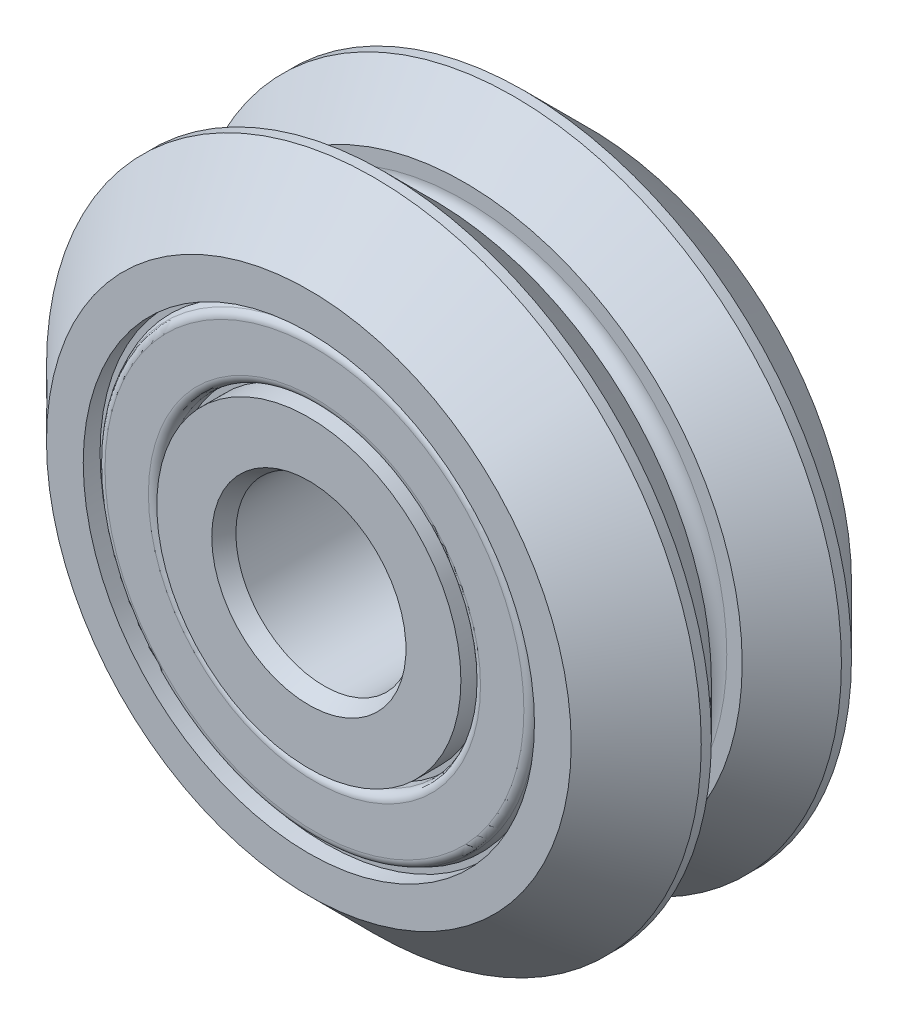
from build123d import *
from build123d.topology import SkipClean

# Parameters (mm, degrees)
SKETCH3_W      = 3.175
SKETCH3_H      = 1.44448
CHAMFER1_SIZE  = 0.2
CHAMFER1_SIZE2 = 0.346410162
FILLET1_R      = 0.1905


with BuildPart() as part:
    # Sketch3 → Revolve1 (revolve)
    with BuildSketch(Plane(origin=(0, 0, 0), x_dir=(0, 0, -1), z_dir=(1, 0, 0)), mode=Mode.PRIVATE) as revolve1_sk:
        with Locations((-1.5875, 2.72224)):
            Rectangle(SKETCH3_W, SKETCH3_H)
    revolve(revolve1_sk.sketch.rotate(Axis((0, 0, 3.175), (0, 0, -1)), 90), axis=Axis((0, 0, 3.175), (0, 0, -1)))

    # Chamfer1
    chamfer1_edges = [part.edges().sort_by_distance(p)[0] for p in [
        (-2, 0, 3.175),
    ]]
    chamfer1_side = [part.faces().sort_by_distance(p)[0] for p in [
        (-2.097424607, 0, 3.175),
    ]]
    chamfer(chamfer1_edges, length=CHAMFER1_SIZE, length2=CHAMFER1_SIZE2, reference=chamfer1_side[0])

    # Mirror1: part across plane


with BuildPart() as body_2:
    # Sketch4 → Revolve2 (revolve)
    with BuildSketch(Plane(origin=(0, 0, 0), x_dir=(0, 0, -1), z_dir=(1, 0, 0)), mode=Mode.PRIVATE) as revolve2_sk:
        with BuildLine():
            Line((0, 5.59435), (0, 3.44448))
            Line((0, 3.44448), (-2.6035, 3.44448))
            Line((-2.6035, 3.44448), (-2.6035, 5.111187692))
            Line((-2.6035, 5.111187692), (-3.175, 5.111187692))
            Line((-3.175, 5.111187692), (-3.175, 5.9436))
            Line((-3.175, 5.9436), (-1.7018, 7.4168))
            Line((-1.7018, 7.4168), (-1.4732, 7.4168))
            Line((-1.4732, 7.4168), (-0.34925, 6.29285))
            Line((-0.34925, 6.29285), (-0.34925, 5.9436))
            ThreePointArc((-0.34925, 5.9436), (-0.246957043, 5.696642957), (0, 5.59435))
        make_face()
    revolve(revolve2_sk.sketch.rotate(Axis((0, 0, 3.175), (0, 0, -1)), 90), axis=Axis((0, 0, 3.175), (0, 0, -1)))

    # Mirror1 2: body 2 across plane


with BuildPart() as body_3:
    # Sketch5 → Revolve3 (revolve)
    with BuildSketch(Plane(origin=(0, 0, 0), x_dir=(0, 0, -1), z_dir=(1, 0, 0)), mode=Mode.PRIVATE) as revolve3_sk:
        Polygon((-2.794, 5.111187692), (-2.6035, 5.111187692), (-2.6035, 3.57148), (-3.048, 3.57148), (-3.048, 4.865745547), (-2.794, 4.984187692), align=None)
    revolve(revolve3_sk.sketch.rotate(Axis((0, 0, 3.175), (0, 0, -1)), 90), axis=Axis((0, 0, 3.175), (0, 0, -1)))

    # Fillet1
    fillet1_edges = [body_3.edges().sort_by_distance(p)[0] for p in [
        (-3.57148, 0, 3.048),
        (-4.865745547, 0, 3.048),
    ]]
    fillet(fillet1_edges, radius=FILLET1_R)


with BuildPart() as part_1:
    add(part.part)
    add(part.part.mirror(Plane.XY))


with BuildPart() as body_2_1:
    with SkipClean():  # the faces are left unmerged after this step: merging them gives an invalid solid
        add(body_2.part)
        add(body_2.part.mirror(Plane.XY))


with BuildPart() as body_4:
    # Mirror2: mirrored copy
    add(body_3.part.mirror(Plane.XY))


solid = Compound([body_3.part, part_1.part, body_2_1.part, body_4.part])
